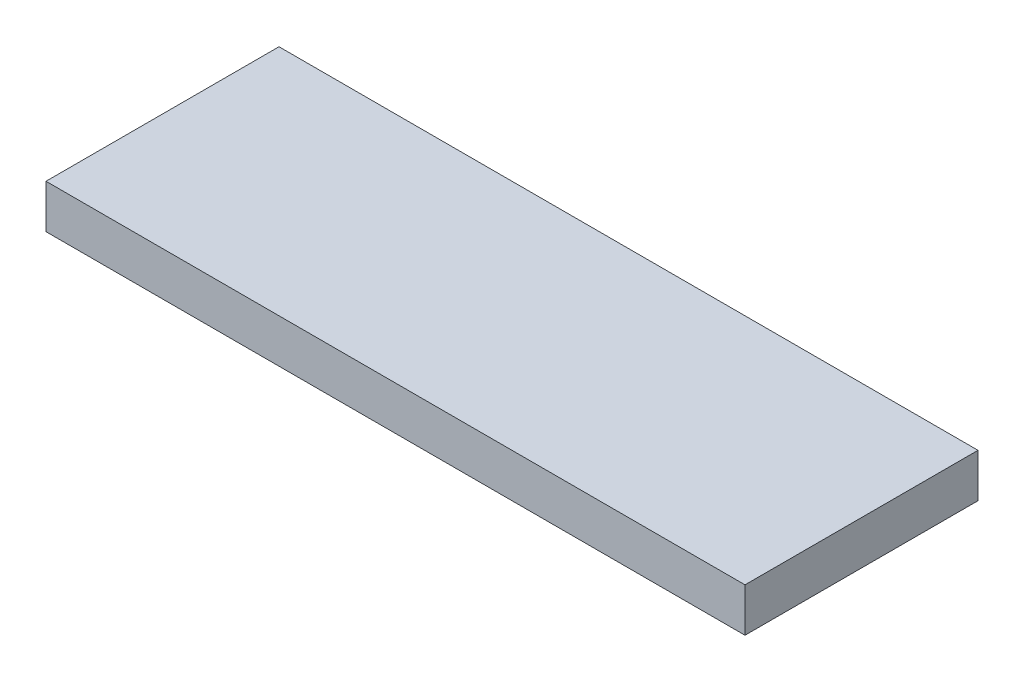
from build123d import *

# Parameters (mm, degrees)
SKETCH1_W           = 76.2
SKETCH1_H           = 25.4
BOSS_EXTRUDE1_DEPTH = 4.7625


with BuildPart() as part:
    # Sketch1 → Boss-Extrude1 (new body)
    with BuildSketch(Plane(origin=(0, 0, 0), x_dir=(1, 0, 0), z_dir=(0, 1, 0))):
        with Locations((38.1, 12.7)):
            Rectangle(SKETCH1_W, SKETCH1_H)
    extrude(amount=BOSS_EXTRUDE1_DEPTH)


solid = part.part
